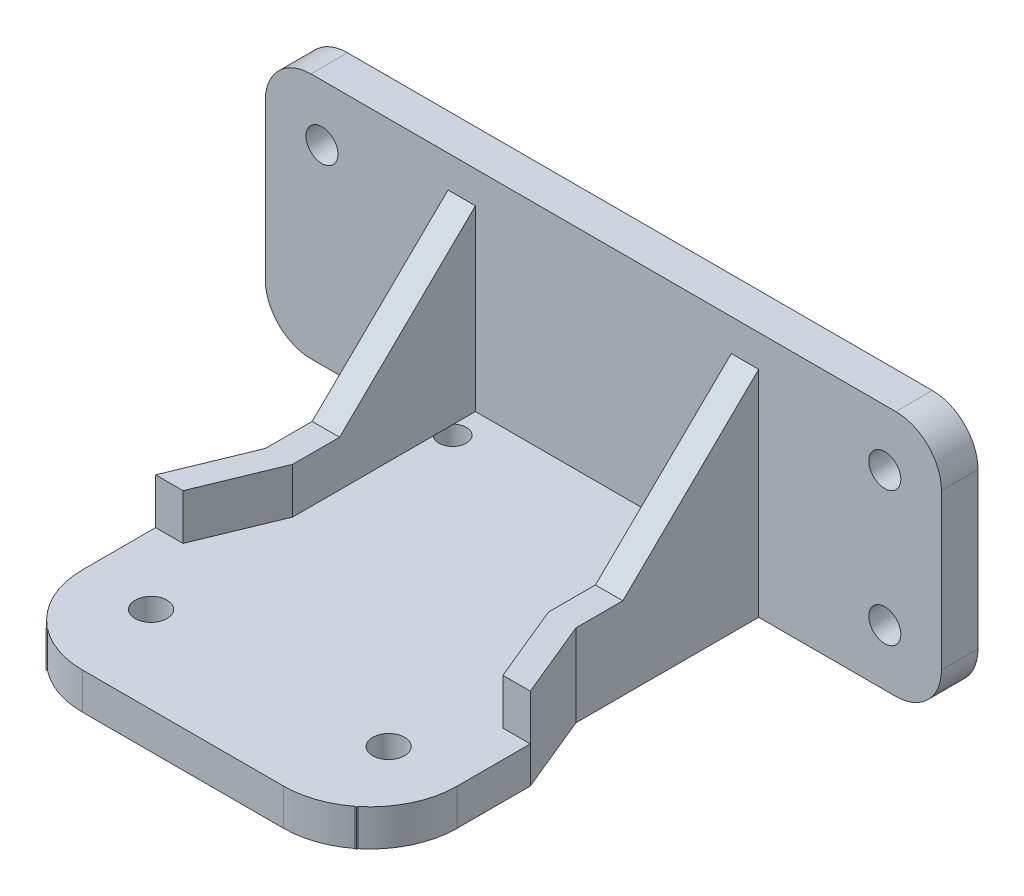
from build123d import *

# Parameters (mm, degrees)
SKETCH_1_W          = 34
SKETCH_1_H          = 51
EXTRUDE_1_DEPTH     = 4
SKETCH_5_W          = 34
SKETCH_5_H          = 15
EXTRUDE_2_DEPTH     = 4
SKETCH_6_R          = 1.5
CUT_EXTRUDE_3_DEPTH = 4
SKETCH_12_W         = 34
SKETCH_12_H         = 4
CUT_EXTRUDE_5_DEPTH = 5
SKETCH_13_W         = 34
SKETCH_13_H         = 4
CUT_EXTRUDE_6_DEPTH = 7
SKETCH_14_W         = 34
SKETCH_14_H         = 4
EXTRUDE_3_DEPTH     = 33
SKETCH_15_R         = 1.75
CUT_EXTRUDE_7_DEPTH = 44
EXTRUDE_4_DEPTH     = 3
EXTRUDE_5_DEPTH     = 3
SKETCH_18_R         = 1.75
EXTRUDE_6_DEPTH     = 4
EXTRUDE_7_DEPTH     = 5
SKETCH_20_W         = 4
SKETCH_20_H         = 43
EXTRUDE_8_DEPTH     = 20
SKETCH_21_W         = 4
SKETCH_21_H         = 43
EXTRUDE_9_DEPTH     = 20
SKETCH_22_W         = 74
SKETCH_22_H         = 4
CUT_EXTRUDE_8_DEPTH = 16
SKETCH_23_R         = 1.75
CUT_EXTRUDE_9_DEPTH = 16
FILLET_1_R          = 5


with BuildPart() as part:
    # 草图1 → 凸台-拉伸1 (new body)
    with BuildSketch(Plane.XY):
        Rectangle(SKETCH_1_W, SKETCH_1_H)
    extrude(amount=EXTRUDE_1_DEPTH)

    # 草图5 → 凸台-拉伸2 (add)
    with BuildSketch(Plane.XZ.offset(25.5)):
        with Locations((0, 7.5)):
            Rectangle(SKETCH_5_W, SKETCH_5_H)
    extrude(amount=EXTRUDE_2_DEPTH)

    # 草图6 → 切除-拉伸3 (cut)
    with BuildSketch(Plane.XZ.offset(29.5)):
        with Locations(Location((13, 7.5, 0), (0, 0, 270))):
            Circle(SKETCH_6_R)
        with Locations(Location((-13, 7.5, 0), (0, 0, 90))):
            Circle(SKETCH_6_R)
    extrude(amount=-CUT_EXTRUDE_3_DEPTH, mode=Mode.SUBTRACT)

    # 草图12 → 切除-拉伸5 (cut)
    with BuildSketch(Plane(origin=(0, 25.5, 0), x_dir=(1, 0, 0), z_dir=(0, 1, 0))):
        with Locations((0, -2)):
            Rectangle(SKETCH_12_W, SKETCH_12_H)
    extrude(amount=-CUT_EXTRUDE_5_DEPTH, mode=Mode.SUBTRACT)

    # 草图13 → 切除-拉伸6 (cut)
    with BuildSketch(Plane(origin=(0, 20.5, 0), x_dir=(1, 0, 0), z_dir=(0, 1, 0))):
        with Locations((0, -2)):
            Rectangle(SKETCH_13_W, SKETCH_13_H)
    extrude(amount=-CUT_EXTRUDE_6_DEPTH, mode=Mode.SUBTRACT)

    # 草图14 → 凸台-拉伸3 (add)
    with BuildSketch(Plane.XY.offset(15)):
        with Locations((0, -27.5)):
            Rectangle(SKETCH_14_W, SKETCH_14_H)
    extrude(amount=EXTRUDE_3_DEPTH)

    # 草图15 → 切除-拉伸7 (cut)
    with BuildSketch(Plane(origin=(0, -25.5, 0), x_dir=(1, 0, 0), z_dir=(0, 1, 0))):
        with Locations(Location((13, -40.5, 0), (0, 0, 270))):
            Circle(SKETCH_15_R)
        with Locations(Location((-13, -40.5, 0), (0, 0, 270))):
            Circle(SKETCH_15_R)
    extrude(amount=-CUT_EXTRUDE_7_DEPTH, mode=Mode.SUBTRACT)

    # 草图16 → 凸台-拉伸4 (add)
    with BuildSketch(Plane.ZY.offset(17)):
        Polygon((4, -25.5), (4, -6), (24, -25.5), align=None)
    extrude(amount=-EXTRUDE_4_DEPTH)

    # 草图17 → 凸台-拉伸5 (add)
    with BuildSketch(Plane(origin=(17, 0, 0), x_dir=(0, 0, -1), z_dir=(1, 0, 0))):
        Polygon((-24, -25.5), (-4, -6), (-4, -25.5), align=None)
    extrude(amount=-EXTRUDE_5_DEPTH)

    # 草图18 → 凸台-拉伸6 (add)
    with BuildSketch(Plane(origin=(0, -25.5, 0), x_dir=(1, 0, 0), z_dir=(0, 1, 0))):
        with BuildLine():
            Line((20.499000769, -32.499999751), (17, -24))
            Line((17, -24), (-17, -24))
            Line((-17, -24), (-20.500999231, -32.499999751))
            Line((-20.500999231, -32.499999751), (-20.500999231, -40.499999751))
            ThreePointArc((-20.500999231, -40.499999751), (-17.718513652, -47.217514172), (-11.000999231, -49.999999751))
            Line((-11.000999231, -49.999999751), (10.999000769, -49.999999751))
            ThreePointArc((10.999000769, -49.999999751), (17.71651519, -47.217514172), (20.499000769, -40.499999751))
            Line((20.499000769, -40.499999751), (20.499000769, -32.499999751))
        make_face()
        with Locations(Location((-13, -40.5, 0), (0, 0, 270))):
            Circle(SKETCH_18_R, mode=Mode.SUBTRACT)
        with Locations(Location((13, -40.5, 0), (0, 0, 270))):
            Circle(SKETCH_18_R, mode=Mode.SUBTRACT)
    extrude(amount=-EXTRUDE_6_DEPTH)

    # 草图19 → 凸台-拉伸7 (add)
    with BuildSketch(Plane(origin=(0, -25.5, 0), x_dir=(1, 0, 0), z_dir=(0, 1, 0))):
        Polygon((-20.500999231, -32.499999751), (-17.500999231, -32.499999751), (-14, -24), (-14, -16), (-17, -16), (-17, -24), align=None)
        Polygon((17, -24), (20.499000769, -32.499999751), (17.499000769, -32.499999751), (14, -24), (14, -16), (17, -16), align=None)
    extrude(amount=EXTRUDE_7_DEPTH)

    # 草图20 → 凸台-拉伸8 (add)
    with BuildSketch(Plane(origin=(17, 0, 0), x_dir=(0, 0, -1), z_dir=(1, 0, 0))):
        with Locations((-2, -8)):
            Rectangle(SKETCH_20_W, SKETCH_20_H)
    extrude(amount=EXTRUDE_8_DEPTH)

    # 草图21 → 凸台-拉伸9 (add)
    with BuildSketch(Plane.ZY.offset(17)):
        with Locations((2, -8)):
            Rectangle(SKETCH_21_W, SKETCH_21_H)
    extrude(amount=EXTRUDE_9_DEPTH)

    # 草图22 → 切除-拉伸8 (cut)
    with BuildSketch(Plane(origin=(0, 13.5, 0), x_dir=(1, 0, 0), z_dir=(0, 1, 0))):
        with Locations((0, -2)):
            Rectangle(SKETCH_22_W, SKETCH_22_H)
    extrude(amount=-CUT_EXTRUDE_8_DEPTH, mode=Mode.SUBTRACT)

    # 草图23 → 切除-拉伸9 (cut)
    with BuildSketch(Plane(origin=(0, 0, 0), x_dir=(-1, 0, 0), z_dir=(0, 0, -1))):
        with Locations((30.8, -8.65)):
            Circle(SKETCH_23_R)
        with Locations((-30.8, -8.65)):
            Circle(SKETCH_23_R)
        with Locations((-30.8, -23.35)):
            Circle(SKETCH_23_R)
        with Locations((20.15, -23.35)):
            Circle(SKETCH_23_R)
    extrude(amount=-CUT_EXTRUDE_9_DEPTH, mode=Mode.SUBTRACT)

    # 圆角1
    fillet_1_edges = [part.edges().sort_by_distance(p)[0] for p in [
        (37, -29.5, 2),
        (-37, -29.5, 2),
        (-37, -2.5, 2),
        (37, -2.5, 2),
    ]]
    fillet(fillet_1_edges, radius=FILLET_1_R)


solid = part.part
